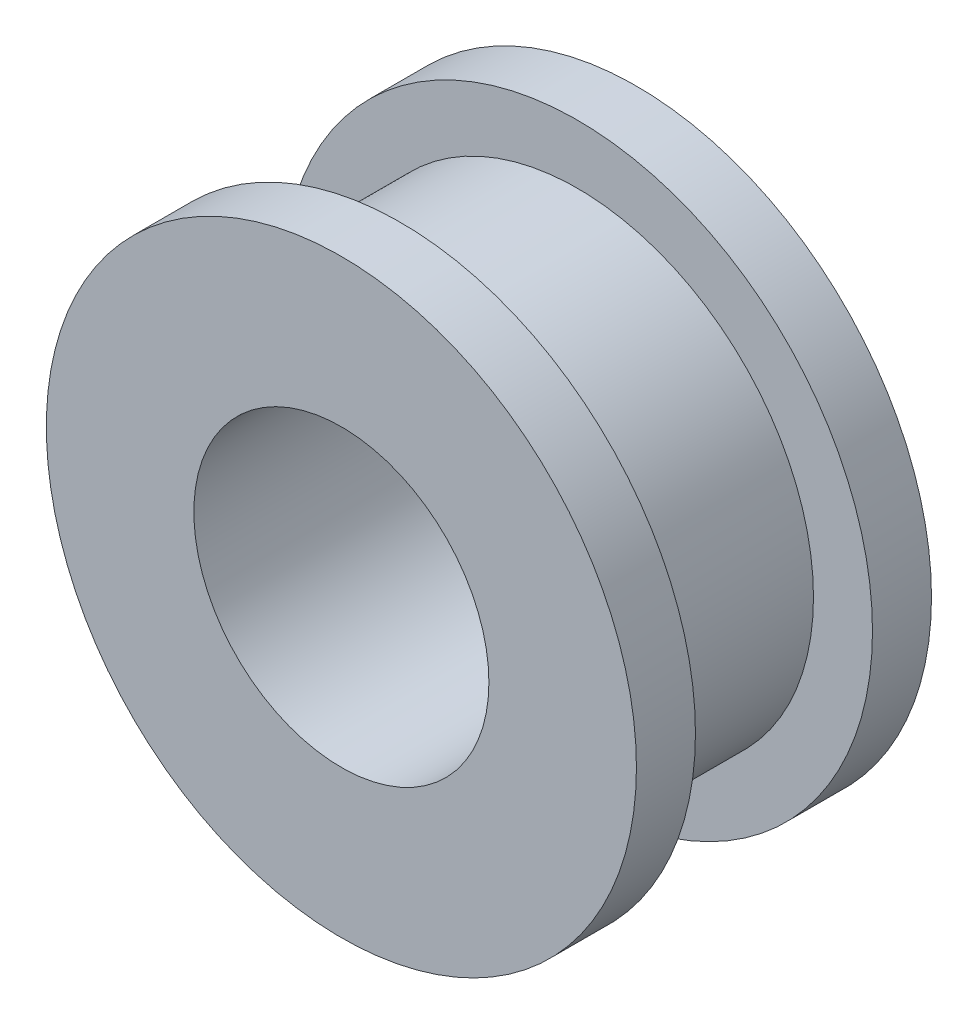
from build123d import *

# Parameters (mm, degrees)
SKETCH1_R           = 5
SKETCH1_R_2         = 2.5
BOSS_EXTRUDE1_DEPTH = 5
CUT_EXTRUDE1_START  = 1
SKETCH1_3_R         = 5
SKETCH1_3_R_2       = 4
CUT_EXTRUDE1_DEPTH  = 3


with BuildPart() as part:
    # Sketch1 → Boss-Extrude1 (new body)
    with BuildSketch(Plane.XY):
        Circle(SKETCH1_R)
        Circle(SKETCH1_R_2, mode=Mode.SUBTRACT)
    extrude(amount=BOSS_EXTRUDE1_DEPTH)

    # Sketch1<3> → Cut-Extrude1 (cut)
    with BuildSketch(Plane.XY.offset(CUT_EXTRUDE1_START)):
        Circle(SKETCH1_3_R)
        Circle(SKETCH1_3_R_2, mode=Mode.SUBTRACT)
    extrude(amount=CUT_EXTRUDE1_DEPTH, mode=Mode.SUBTRACT)


solid = part.part
